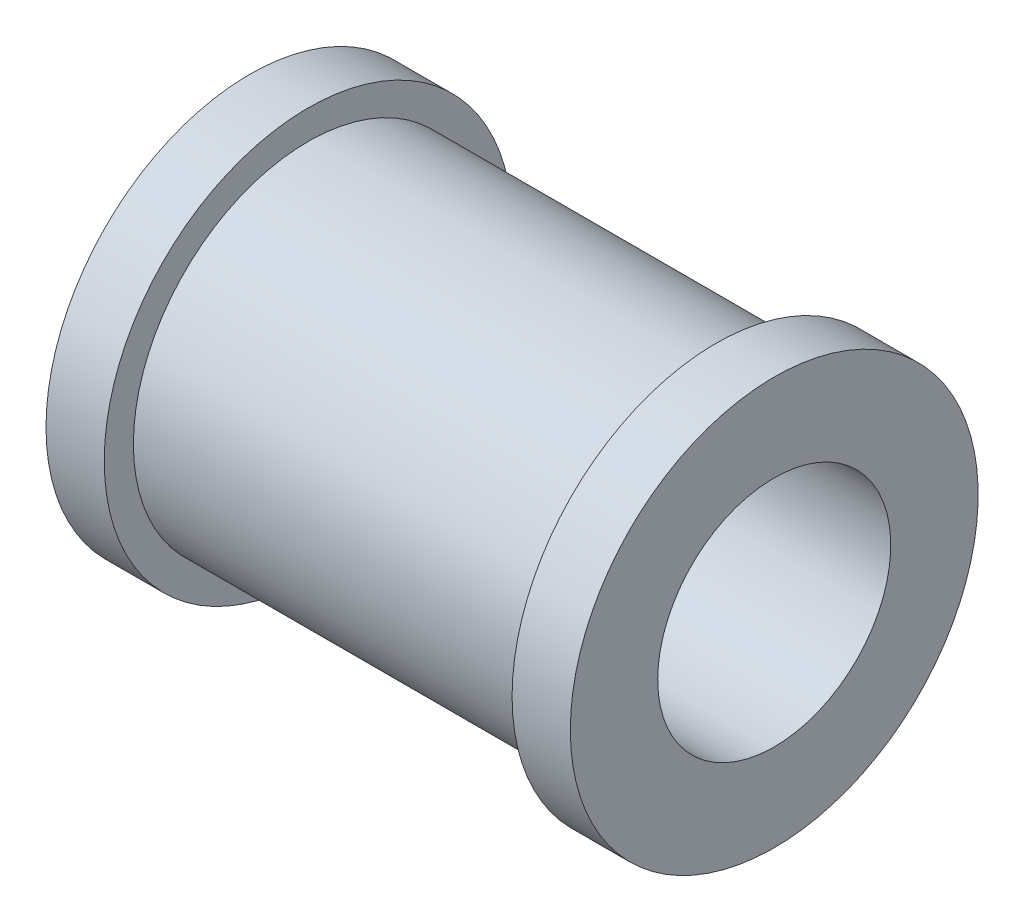
from build123d import *


with BuildPart() as part:
    # Sketch1 → Revolve2 (revolve)
    with BuildSketch(Plane.XY, mode=Mode.PRIVATE) as revolve2_sk:
        Polygon((0, 4), (0, 7), (2, 7), (2, 6), (16, 6), (16, 7), (18, 7), (18, 4), align=None)
    revolve(revolve2_sk.sketch.rotate(Axis((0, 0, 0), (1, 0, 0)), 90), axis=Axis((0, 0, 0), (1, 0, 0)))


solid = part.part
